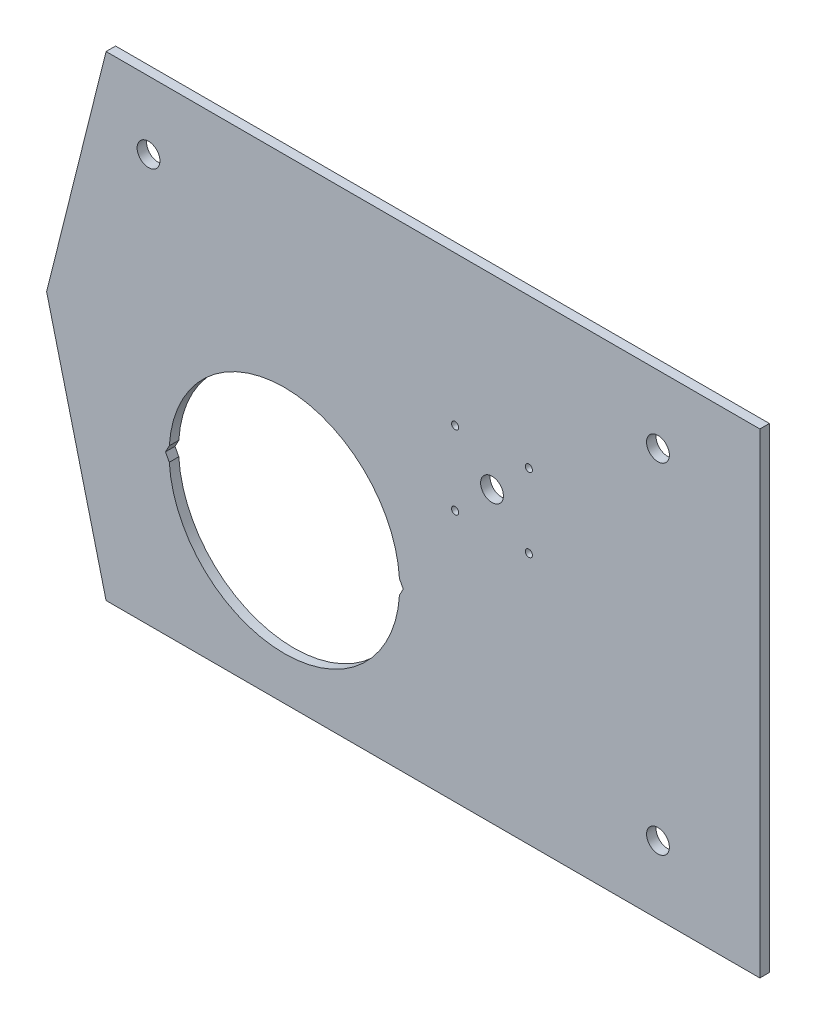
from build123d import *

# Parameters (mm, degrees)
SKETCH1_R           = 4.8
SKETCH1_R_2         = 1.5
BOSS_EXTRUDE3_DEPTH = 4


with BuildPart() as part:
    # Sketch1 → Boss-Extrude3 (new body)
    with BuildSketch(Plane.XY):
        Polygon((-125, -100), (150, -100), (150, 100), (-125, 100), (-150, 0), align=None)
        with BuildLine():
            Line((0, -33.333333333), (-1.592872426, -36.333333333))
            ThreePointArc((-1.592872426, -36.333333333), (-50, -81.833333333), (-98.407127574, -36.333333333))
            Line((-98.407127574, -36.333333333), (-100, -33.333333333))
            Line((-100, -33.333333333), (-98.407127574, -30.333333333))
            ThreePointArc((-98.407127574, -30.333333333), (-50, 15.166666667), (-1.592872426, -30.333333333))
            Line((-1.592872426, -30.333333333), (0, -33.333333333))
        make_face(mode=Mode.SUBTRACT)
        with Locations((107.142857143, -71.428571429)):
            Circle(SKETCH1_R, mode=Mode.SUBTRACT)
        with Locations((-107.142857143, 71.428571429)):
            Circle(SKETCH1_R, mode=Mode.SUBTRACT)
        with Locations((21.832408692, 6.152026506)):
            Circle(SKETCH1_R_2, mode=Mode.SUBTRACT)
        with Locations((37.332408692, 21.652026506)):
            Circle(SKETCH1_R, mode=Mode.SUBTRACT)
        with Locations((52.832408692, 6.152026506)):
            Circle(SKETCH1_R_2, mode=Mode.SUBTRACT)
        with Locations((21.832408692, 37.152026506)):
            Circle(SKETCH1_R_2, mode=Mode.SUBTRACT)
        with Locations((52.832408692, 37.152026506)):
            Circle(SKETCH1_R_2, mode=Mode.SUBTRACT)
        with Locations((107.142857143, 71.428571429)):
            Circle(SKETCH1_R, mode=Mode.SUBTRACT)
    extrude(amount=BOSS_EXTRUDE3_DEPTH)


solid = part.part
